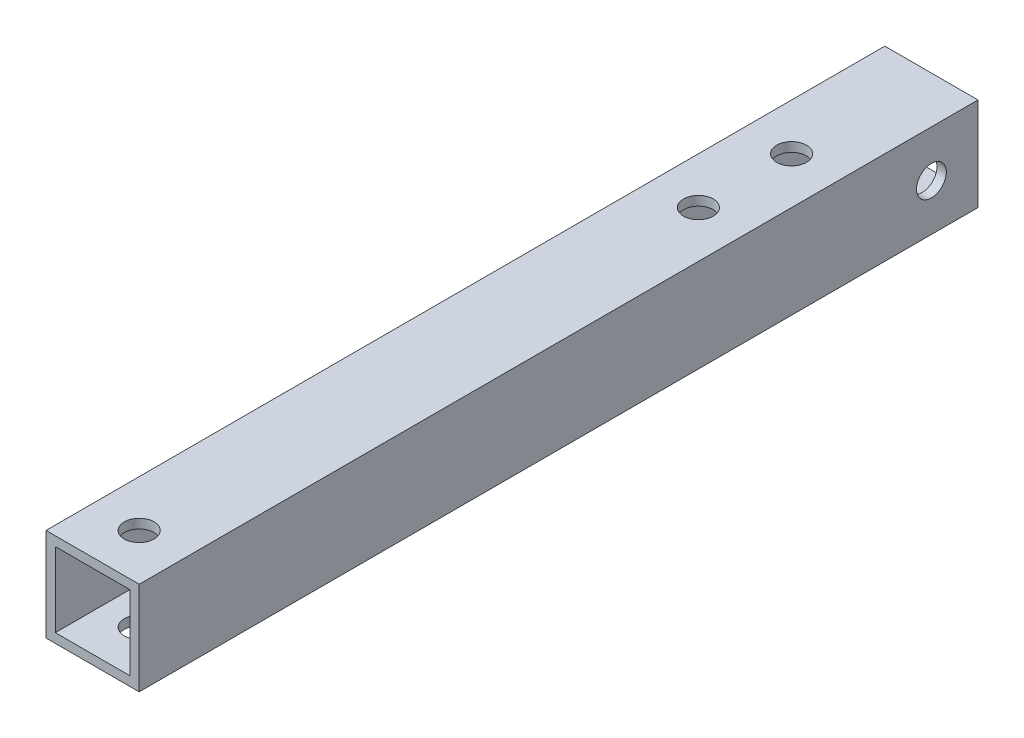
from build123d import *

# Parameters (mm, degrees)
SKETCH_1_W          = 10
SKETCH_1_H          = 10
SKETCH_1_W_2        = 8
SKETCH_1_H_2        = 8
EXTRUDE_1_DEPTH     = 90
SKETCH_2_R          = 1.6
CUT_EXTRUDE_1_DEPTH = 91.691785736
SKETCH_3_R          = 1.6
CUT_EXTRUDE_2_DEPTH = 60


with BuildPart() as part:
    # ｽｹｯﾁ1 → ﾎﾞｽ - 押し出し1 (new body)
    with BuildSketch(Plane.XY):
        Rectangle(SKETCH_1_W, SKETCH_1_H)
        Rectangle(SKETCH_1_W_2, SKETCH_1_H_2, mode=Mode.SUBTRACT)
    extrude(amount=EXTRUDE_1_DEPTH)

    # ｽｹｯﾁ2 → ｶｯﾄ - 押し出し1 (cut, through all)
    with BuildSketch(Plane(origin=(0, 5, 0), x_dir=(1, 0, 0), z_dir=(0, 1, 0))):
        with Locations(Location((0, -15, 0), (0, 0, 180))):
            Circle(SKETCH_2_R)
        with Locations(Location((0, -85, 0), (0, 0, 180))):
            Circle(SKETCH_2_R)
        with Locations(Location((0, -25, 0), (0, 0, 180))):
            Circle(SKETCH_2_R)
    extrude(amount=-CUT_EXTRUDE_1_DEPTH, mode=Mode.SUBTRACT)

    # ｽｹｯﾁ3 → ｶｯﾄ - 押し出し2 (cut)
    with BuildSketch(Plane(origin=(5, 0, 0), x_dir=(0, 0, -1), z_dir=(1, 0, 0))):
        with Locations((-5, 0)):
            Circle(SKETCH_3_R)
    extrude(amount=-CUT_EXTRUDE_2_DEPTH, mode=Mode.SUBTRACT)


solid = part.part
